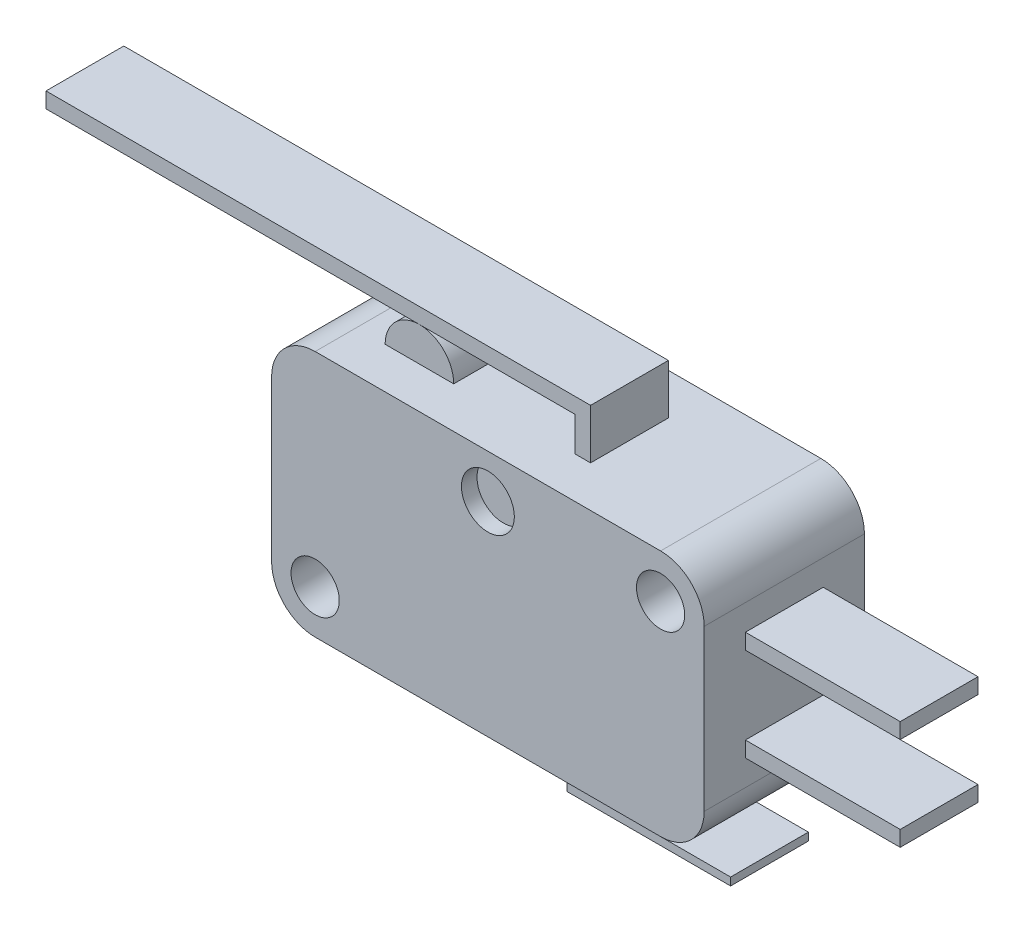
from build123d import *

# Parameters (mm, degrees)
CROQUIS1_R                = 1.55
SALIENTE_EXTRUIR1_DEPTH   = 10.3
CROQUIS2_R                = 1.7
CORTAR_EXTRUIR1_DEPTH     = 1
CORTAR_EXTRUIR2_START     = -1
CROQUIS3_R                = 1.7
CORTAR_EXTRUIR2_DEPTH     = 1
SALIENTE_EXTRUIR2_DEPTH   = 2.5
SALIENTE_EXTRUIR2_2_DEPTH = 2.5
CROQUIS4_W                = 10
CROQUIS4_H                = 1
SALIENTE_EXTRUIR2_3_DEPTH = 2.5
SALIENTE_EXTRUIR2_4_DEPTH = 2.5
SALIENTE_EXTRUIR2_5_DEPTH = 2.5


with BuildPart() as part:
    # Croquis1 → Saliente-Extruir1 (new body)
    with BuildSketch(Plane.XY):
        with BuildLine():
            Line((-11.1, 7.95), (11.1, 7.95))
            ThreePointArc((11.1, 7.95), (13.079898987, 7.129898987), (13.9, 5.15))
            Line((13.9, 5.15), (13.9, -5.15))
            ThreePointArc((13.9, -5.15), (13.079898987, -7.129898987), (11.1, -7.95))
            Line((11.1, -7.95), (-11.1, -7.95))
            ThreePointArc((-11.1, -7.95), (-13.079898987, -7.129898987), (-13.9, -5.15))
            Line((-13.9, -5.15), (-13.9, 5.15))
            ThreePointArc((-13.9, 5.15), (-13.079898987, 7.129898987), (-11.1, 7.95))
        make_face()
        with Locations(Location((11.1, 5.15, 0), (0, 0, 180))):
            Circle(CROQUIS1_R, mode=Mode.SUBTRACT)
        with Locations(Location((-11.1, -5.15, 0), (0, 0, 180))):
            Circle(CROQUIS1_R, mode=Mode.SUBTRACT)
    extrude(amount=SALIENTE_EXTRUIR1_DEPTH)

    # Croquis2 → Cortar-Extruir1 (cut)
    with BuildSketch(Plane.XY.offset(10.3)):
        with Locations((0, 5.15)):
            Circle(CROQUIS2_R)
    extrude(amount=-CORTAR_EXTRUIR1_DEPTH, mode=Mode.SUBTRACT)

    # Croquis3 → Cortar-Extruir2 (cut)
    with BuildSketch(Plane(origin=(0, 0, 0), x_dir=(-1, 0, 0), z_dir=(0, 0, -1)).offset(CORTAR_EXTRUIR2_START)):
        with Locations(Location((0, 5.15, 0), (0, 0, 180))):
            Circle(CROQUIS3_R)
    extrude(amount=CORTAR_EXTRUIR2_DEPTH, mode=Mode.SUBTRACT)


with BuildPart() as body_2:
    # Croquis4 → Saliente-Extruir2 (new, symmetric)
    with BuildSketch(Plane(origin=(0, 0, 5.15), x_dir=(-1, 0, 0), z_dir=(0, 0, -1))):
        Polygon((-3.95, 7.95), (-2.95, 7.95), (-2.95, 10.153629865), (31.05, 10.153629865), (31.05, 11.153629865), (-3.95, 11.153629865), align=None)
    extrude(amount=SALIENTE_EXTRUIR2_DEPTH, both=True)


with BuildPart() as body_3:
    # Croquis4 → Saliente-Extruir2 2 (new, symmetric)
    with BuildSketch(Plane(origin=(0, 0, 5.15), x_dir=(-1, 0, 0), z_dir=(0, 0, -1))):
        with BuildLine():
            Line((9.253629865, 7.95), (4.846370135, 7.95))
            ThreePointArc((4.846370135, 7.95), (7.05, 10.153629865), (9.253629865, 7.95))
        make_face()
    extrude(amount=SALIENTE_EXTRUIR2_2_DEPTH, both=True)


with BuildPart() as body_4:
    # Croquis4 → Saliente-Extruir2 3 (new, symmetric)
    with BuildSketch(Plane(origin=(0, 0, 5.15), x_dir=(-1, 0, 0), z_dir=(0, 0, -1))):
        with Locations((-18.85, 3)):
            Rectangle(CROQUIS4_W, CROQUIS4_H)
    extrude(amount=SALIENTE_EXTRUIR2_3_DEPTH, both=True)


with BuildPart() as body_5:
    # Croquis4 → Saliente-Extruir2 4 (new, symmetric)
    with BuildSketch(Plane(origin=(0, 0, 5.15), x_dir=(-1, 0, 0), z_dir=(0, 0, -1))):
        with Locations((-18.85, -3)):
            Rectangle(CROQUIS4_W, CROQUIS4_H)
    extrude(amount=SALIENTE_EXTRUIR2_4_DEPTH, both=True)


with BuildPart() as body_6:
    # Croquis4 → Saliente-Extruir2 5 (new, symmetric)
    with BuildSketch(Plane(origin=(0, 0, 5.15), x_dir=(-1, 0, 0), z_dir=(0, 0, -1))):
        Polygon((-12.95, -11.1), (-2.45, -11.1), (-2.45, -7.95), (-2.95, -7.95), (-2.95, -10.6), (-12.95, -10.6), align=None)
    extrude(amount=SALIENTE_EXTRUIR2_5_DEPTH, both=True)


solid = Compound([part.part, body_2.part, body_3.part, body_4.part, body_5.part, body_6.part])
